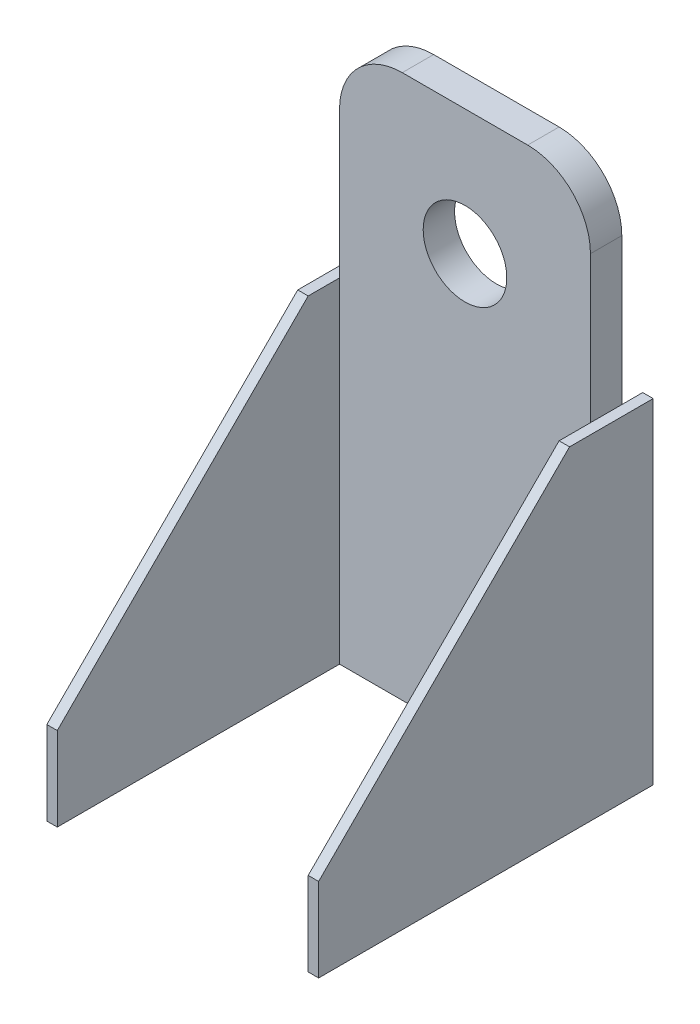
from build123d import *

# Parameters (mm, degrees)
SKETCH2_W           = 152.4
SKETCH2_H           = 330.2
BOSS_EXTRUDE1_DEPTH = 19.05
SKETCH5_R           = 25.4
CUT_EXTRUDE1_DEPTH  = 266.867151976
FILLET1_R           = 38.1
BOSS_EXTRUDE2_DEPTH = 6.35


with BuildPart() as part:
    # Sketch2 → Boss-Extrude1 (new body)
    with BuildSketch(Plane.XY):
        with Locations((0, -88.9)):
            Rectangle(SKETCH2_W, SKETCH2_H)
    extrude(amount=BOSS_EXTRUDE1_DEPTH)

    # Sketch5 → Cut-Extrude1 (cut, through all)
    with BuildSketch(Plane.XY):
        with Locations(Location((0, 0, 0), (0, 0, 180))):
            Circle(SKETCH5_R)
    extrude(amount=CUT_EXTRUDE1_DEPTH, mode=Mode.SUBTRACT)

    # Fillet1
    fillet1_edges = [part.edges().sort_by_distance(p)[0] for p in [
        (-76.2, 76.2, 9.525),
        (76.2, 76.2, 9.525),
    ]]
    fillet(fillet1_edges, radius=FILLET1_R)

    # Sketch3 → Boss-Extrude2 (add)
    with BuildSketch(Plane(origin=(76.2, 0, 0), x_dir=(0, 0, -1), z_dir=(1, 0, 0))):
        Polygon((12.7, -50.8), (12.7, -254), (-190.5, -254), (-190.5, -203.2), (-38.1, -50.8), align=None)
    boss_extrude2 = extrude(amount=BOSS_EXTRUDE2_DEPTH)

    # Mirror1: Boss-Extrude2 across plane
    add(boss_extrude2.mirror(Plane(origin=(0, 0, 0), x_dir=(0, 0, 1), z_dir=(1, 0, 0))))


solid = part.part
